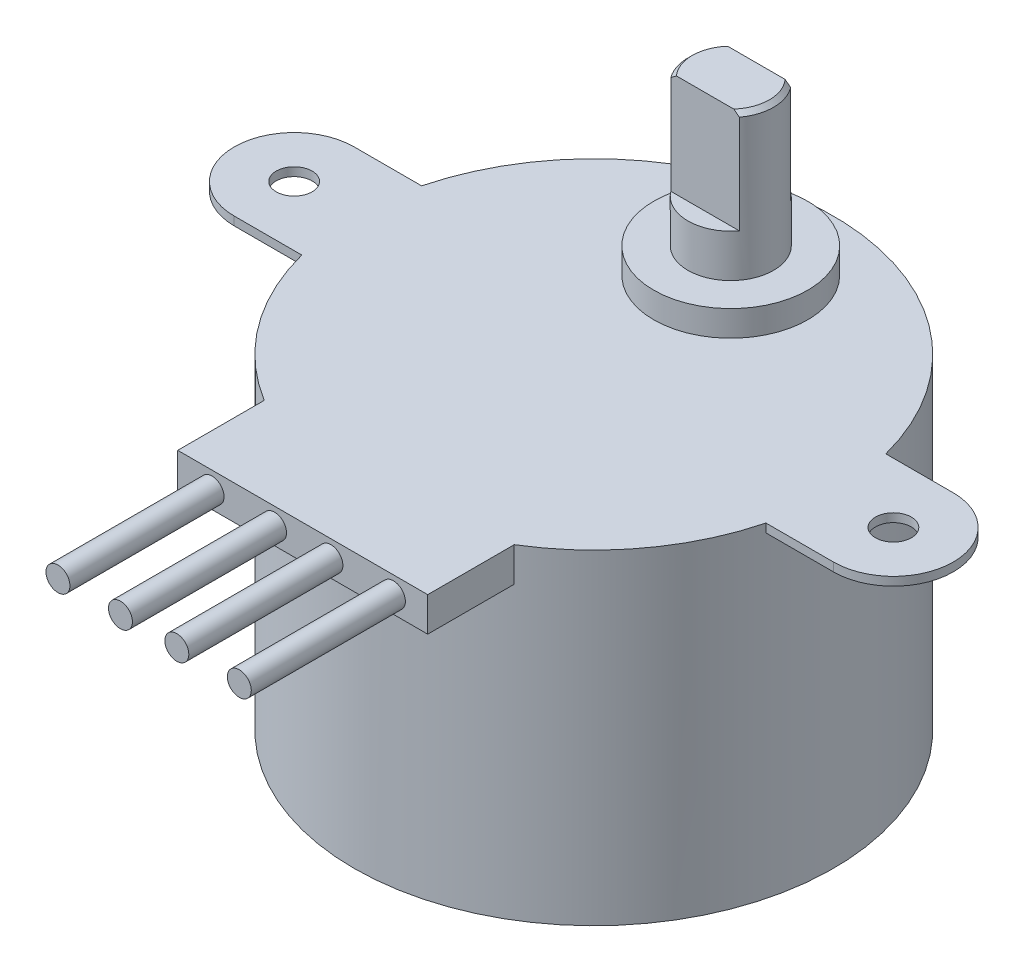
from build123d import *

# Parameters (mm, degrees)
SKETCH1_R           = 14
BOSS_EXTRUDE1_DEPTH = 19
SKETCH2_R           = 4.5
BOSS_EXTRUDE2_DEPTH = 1.5
SKETCH3_R           = 2.5
BOSS_EXTRUDE3_DEPTH = 2.5
SKETCH4_R           = 2.5
BOSS_EXTRUDE4_DEPTH = 6
CHAMFER1_SIZE       = 0.25
BOSS_EXTRUDE5_START = -0.5
SKETCH6_R           = 1.05
BOSS_EXTRUDE5_DEPTH = 0.5
CUT_EXTRUDE1_DEPTH  = 6
SKETCH8_W           = 14.6
SKETCH8_H           = 17
BOSS_EXTRUDE6_DEPTH = 2
SKETCH9_R           = 0.7
BOSS_EXTRUDE7_DEPTH = 9


with BuildPart() as part:
    # Sketch1 → Boss-Extrude1 (new body)
    with BuildSketch(Plane(origin=(0, 0, 0), x_dir=(1, 0, 0), z_dir=(0, 1, 0))):
        with Locations(Location((0, 0, 0), (0, 0, 270))):
            Circle(SKETCH1_R)
    extrude(amount=BOSS_EXTRUDE1_DEPTH)

    # Sketch2 → Boss-Extrude2 (add)
    with BuildSketch(Plane(origin=(0, 19, 0), x_dir=(1, 0, 0), z_dir=(0, 1, 0))):
        with Locations(Location((0, 8, 0), (0, 0, 270))):
            Circle(SKETCH2_R)
    extrude(amount=BOSS_EXTRUDE2_DEPTH)

    # Sketch3 → Boss-Extrude3 (add)
    with BuildSketch(Plane(origin=(0, 20.5, 0), x_dir=(1, 0, 0), z_dir=(0, 1, 0))):
        with Locations(Location((0, 8, 0), (0, 0, 270))):
            Circle(SKETCH3_R)
    extrude(amount=BOSS_EXTRUDE3_DEPTH)

    # Sketch4 → Boss-Extrude4 (add)
    with BuildSketch(Plane(origin=(0, 23, 0), x_dir=(1, 0, 0), z_dir=(0, 1, 0))):
        with Locations(Location((0, 8, 0), (0, 0, 270))):
            Circle(SKETCH4_R)
    extrude(amount=BOSS_EXTRUDE4_DEPTH)

    # Chamfer1
    chamfer1_edges = [part.edges().sort_by_distance(p)[0] for p in [
        (0, 29, -10.5),
    ]]
    chamfer(chamfer1_edges, length=CHAMFER1_SIZE)

    # Sketch6 → Boss-Extrude5 (add)
    # profile 1 of 2: a face of its own
    with BuildSketch(Plane(origin=(0, 19, 0), x_dir=(1, 0, 0), z_dir=(0, 1, 0)).offset(BOSS_EXTRUDE5_START)):
        with BuildLine():
            Line((-13.555441712, 3.5), (-17.5, 3.5))
            ThreePointArc((-17.5, 3.5), (-21, 0), (-17.5, -3.5))
            Line((-17.5, -3.5), (-13.555441712, -3.5))
            ThreePointArc((-13.555441712, -3.5), (-14, 0), (-13.555441712, 3.5))
        make_face()
        with Locations(Location((-17.5, 0, 0), (0, 0, 270))):
            Circle(SKETCH6_R, mode=Mode.SUBTRACT)
    # profile 2 of 2: a face of its own
    with BuildSketch(Plane(origin=(0, 19, 0), x_dir=(1, 0, 0), z_dir=(0, 1, 0)).offset(BOSS_EXTRUDE5_START)):
        with BuildLine():
            Line((17.5, 3.5), (13.555441712, 3.5))
            ThreePointArc((13.555441712, 3.5), (13.888415748, 1.764060095), (14, 0))
            ThreePointArc((14, 0), (13.888415748, -1.764060095), (13.555441712, -3.5))
            Line((13.555441712, -3.5), (17.5, -3.5))
            ThreePointArc((17.5, -3.5), (21, 0), (17.5, 3.5))
        make_face()
        with BuildLine():
            ThreePointArc((16.45, 0), (17.5, 1.05), (18.55, 0))
            ThreePointArc((18.55, 0), (17.5, -1.05), (16.45, 0))
        make_face(mode=Mode.SUBTRACT)
    extrude(amount=BOSS_EXTRUDE5_DEPTH)

    # Sketch7 → Cut-Extrude1 (cut)
    with BuildSketch(Plane(origin=(0, 29, 0), x_dir=(1, 0, 0), z_dir=(0, 1, 0))):
        Polygon((0, 9.5), (-3.852733209, 9.5), (-3.852733209, 12.808282557), (3.692444336, 12.808282557), (3.692444336, 9.5), align=None)
        Polygon((3.692444336, 6.5), (0, 6.5), (-3.852733209, 6.5), (-3.852733209, 3.191717443), (3.692444336, 3.191717443), align=None)
    extrude(amount=-CUT_EXTRUDE1_DEPTH, mode=Mode.SUBTRACT)

    # Sketch8 → Boss-Extrude6 (add)
    with BuildSketch(Plane(origin=(0, 19, 0), x_dir=(1, 0, 0), z_dir=(0, 1, 0))):
        with Locations((0, -8.5)):
            Rectangle(SKETCH8_W, SKETCH8_H)
    extrude(amount=-BOSS_EXTRUDE6_DEPTH)

    # Sketch9 → Boss-Extrude7 (add)
    with BuildSketch(Plane.XY.offset(17)):
        with Locations((-1.645828478, 18)):
            Circle(SKETCH9_R)
        with Locations((1.645828478, 18)):
            Circle(SKETCH9_R)
        with Locations((5.295828478, 18)):
            Circle(SKETCH9_R)
        with Locations((-5.295828478, 18)):
            Circle(SKETCH9_R)
    extrude(amount=BOSS_EXTRUDE7_DEPTH)


solid = part.part
